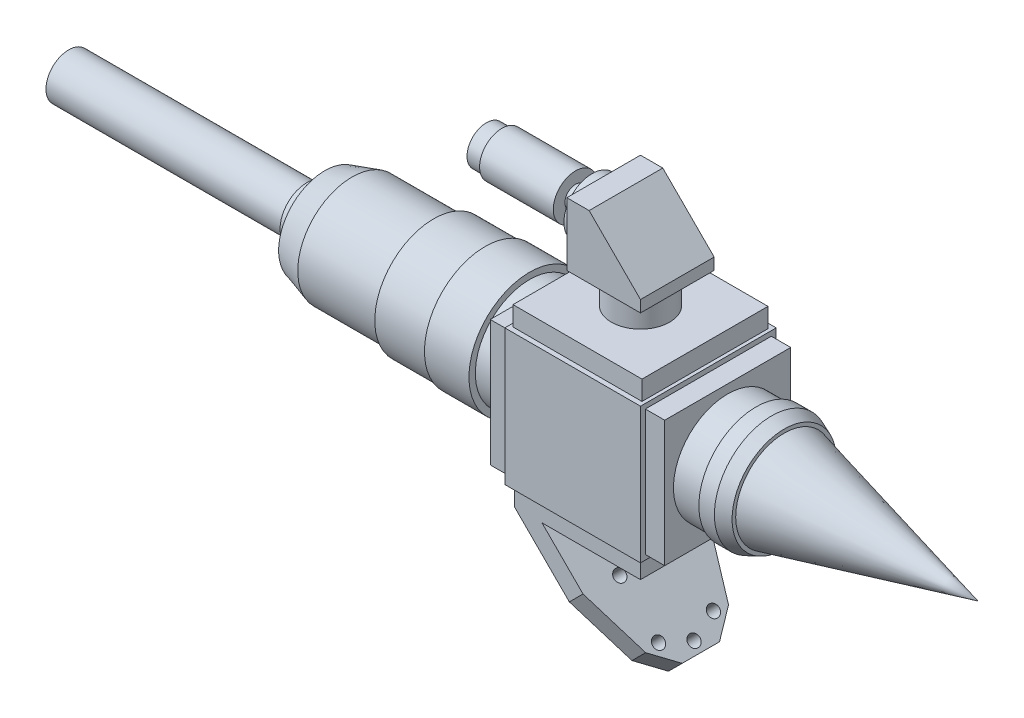
from build123d import *

# Parameters (mm, degrees)
BOSS_EXTRUDE1_DEPTH       = 35
BOSS_EXTRUDE1_DEPTH_BACK  = 35
SKETCH2_W                 = 70
SKETCH2_H                 = 70
BOSS_EXTRUDE2_DEPTH       = 32.5
BOSS_EXTRUDE2_DEPTH_BACK  = 32.5
SKETCH3_W                 = 10
SKETCH3_H                 = 65
BOSS_EXTRUDE10_DEPTH      = 32.5
BOSS_EXTRUDE10_DEPTH_BACK = 32.5
SKETCH20_W                = 10
SKETCH20_H                = 65
SKETCH6_W                 = 65
SKETCH6_H                 = 65
BOSS_EXTRUDE4_DEPTH       = 10
BOSS_EXTRUDE6_DEPTH       = 32.5
BOSS_EXTRUDE6_DEPTH_BACK  = 32.5
SKETCH12_W                = 66.54355119
SKETCH12_H                = 10
SKETCH13_W                = 15
SKETCH13_H                = 15.886543597
BOSS_EXTRUDE7_DEPTH       = 19
BOSS_EXTRUDE7_DEPTH_BACK  = 19
SKETCH16_W                = 15.65
SKETCH16_H                = 15
BOSS_EXTRUDE14_DEPTH      = 65
CUT_EXTRUDE2_REACH        = 292.31
SKETCH25_R                = 3.001207037
SKETCH25_R_2              = 3
CUT_EXTRUDE3_REACH        = 292.31


with BuildPart() as part:
    # Sketch2 → Boss-Extrude1 (new, two sides: drawn at the far end of the back side and taken through both)
    with BuildSketch(Plane.XY.offset(-BOSS_EXTRUDE1_DEPTH_BACK)):
        Rectangle(SKETCH2_W, SKETCH2_H)
    extrude(amount=BOSS_EXTRUDE1_DEPTH + BOSS_EXTRUDE1_DEPTH_BACK)

    # Sketch3 → Boss-Extrude2 (add, two sides: drawn at the far end of the back side and taken through both)
    with BuildSketch(Plane.XY.offset(-BOSS_EXTRUDE2_DEPTH_BACK)):
        with Locations((40, 0)):
            Rectangle(SKETCH3_W, SKETCH3_H)
    extrude(amount=BOSS_EXTRUDE2_DEPTH + BOSS_EXTRUDE2_DEPTH_BACK)

    # Sketch20 → Boss-Extrude10 (add, two sides: drawn at the far end of the back side and taken through both)
    with BuildSketch(Plane.XY.offset(-BOSS_EXTRUDE10_DEPTH_BACK)):
        with Locations((-40, 0)):
            Rectangle(SKETCH20_W, SKETCH20_H)
    extrude(amount=BOSS_EXTRUDE10_DEPTH + BOSS_EXTRUDE10_DEPTH_BACK)

    # Sketch4 → Revolve1 (revolve)
    with BuildSketch(Plane.XY, mode=Mode.PRIVATE) as revolve1_sk:
        Polygon((45, 28), (59.607985015, 28), (59.607985015, 29.5), (67.607985015, 29.5), (74.107985015, 26.85697368), (74.107985015, 0), (45, 0), align=None)
    revolve(revolve1_sk.sketch.rotate(Axis((126.079032841, 0, 0), (-1, 0, 0)), 90), axis=Axis((126.079032841, 0, 0), (-1, 0, 0)))

    # Sketch5 → Revolve2 (revolve)
    with BuildSketch(Plane.XY, mode=Mode.PRIVATE) as revolve2_sk:
        Polygon((74.107985015, 25), (174.107985015, 0), (74.107985015, 0), align=None)
    revolve(revolve2_sk.sketch.rotate(Axis((0, 0, 0), (1, 0, 0)), 90), axis=Axis((0, 0, 0), (1, 0, 0)))

    # Sketch11 → Revolve4 (revolve)
    with BuildSketch(Plane.XY, mode=Mode.PRIVATE) as revolve4_sk:
        Polygon((-45, 28), (-57.201085702, 28), (-57.201085702, 31.288573188), (-80.147769564, 31.288573188), (-80.147769564, 30.339674147), (-106.73557157, 30.339674147), (-106.73557157, 28), (-148.804473643, 28), (-162.901896786, 23.768340348), (-162.901896786, 13.75175022), (-172.176517275, 13.75175022), (-172.176517275, 11.711333713), (-294.985996393, 11.711333713), (-294.985996393, 0), (-45, 0), align=None)
    revolve(revolve4_sk.sketch.rotate(Axis((0, 0, 0), (-1, 0, 0)), 90), axis=Axis((0, 0, 0), (-1, 0, 0)))

    # Sketch6 → Boss-Extrude4 (add)
    with BuildSketch(Plane.XZ.offset(35)):
        Rectangle(SKETCH6_W, SKETCH6_H)
    extrude(amount=BOSS_EXTRUDE4_DEPTH)

    # Sketch12 → Boss-Extrude6 (add, two sides: drawn at the far end of the back side and taken through both)
    with BuildSketch(Plane.XY.offset(-BOSS_EXTRUDE6_DEPTH_BACK)):
        with Locations((0, 40)):
            Rectangle(SKETCH12_W, SKETCH12_H)
    extrude(amount=BOSS_EXTRUDE6_DEPTH + BOSS_EXTRUDE6_DEPTH_BACK)

    # Sketch13 → Revolve5 (revolve)
    with BuildSketch(Plane.XY, mode=Mode.PRIVATE) as revolve5_sk:
        with Locations((7.5, 52.943271799)):
            Rectangle(SKETCH13_W, SKETCH13_H)
    revolve(revolve5_sk.sketch.rotate(Axis((0, 0, 0), (0, 1, 0)), 90), axis=Axis((0, 0, 0), (0, 1, 0)))

    # Sketch14 → Boss-Extrude7 (add, two sides: drawn at the far end of the back side and taken through both)
    with BuildSketch(Plane.XY.offset(-BOSS_EXTRUDE7_DEPTH_BACK)):
        Polygon((-19, 60.650657798), (19, 60.650657798), (19, 66.650657798), (-7.5, 93.150657798), (-19, 93.150657798), align=None)
    extrude(amount=BOSS_EXTRUDE7_DEPTH + BOSS_EXTRUDE7_DEPTH_BACK)

    # Sketch15 → Revolve6 (revolve)
    with BuildSketch(Plane.XY):
        Polygon((-19, 91.400657798), (-25, 91.400657798), (-25, 82.400657798), (-33.5, 82.400657798), (-33.5, 88.400657798), (-71.5, 88.400657798), (-71.5, 86.900657798), (-79.5, 86.900657798), (-79.5, 76.900657798), (-19, 76.900657798), align=None)
    revolve(axis=Axis((23.08157289, 76.900657798, 0), (-1, 0, 0)))

    # Sketch16 → Revolve7 (revolve)
    with BuildSketch(Plane.XY):
        with Locations((-52.825, 7.5)):
            Rectangle(SKETCH16_W, SKETCH16_H)
    revolve(axis=Axis((0, 0, 0), (-1, 0, 0)))

    # Sketch24 → Boss-Extrude14 (add)
    with BuildSketch(Plane.XY.offset(32.5)):
        Polygon((-32.5, -45), (24.068542495, -101.568542495), (31.139610307, -94.497474683), (-18.357864376, -45), align=None)
    extrude(amount=-BOSS_EXTRUDE14_DEPTH)

    # Sketch25 → Cut-Extrude2 (cut, up to next)
    with BuildSketch(Plane(origin=(-38.75, -38.75, 0), x_dir=(0, 0, 1), z_dir=(-0.7071067811865438, -0.7071067811865512, 0)), mode=Mode.PRIVATE) as cut_extrude2_sk1:
        with Locations(Location((0, -83.838834765, 0), (0, 0, 270))):
            Circle(SKETCH25_R)
    cut_extrude2_tool1 = extrude(cut_extrude2_sk1.sketch, amount=-CUT_EXTRUDE2_REACH, mode=Mode.PRIVATE) & part.part
    # Sketch25 → Cut-Extrude2 (cut, up to next)
    with BuildSketch(Plane(origin=(-38.75, -38.75, 0), x_dir=(0, 0, 1), z_dir=(-0.7071067811865438, -0.7071067811865512, 0)), mode=Mode.PRIVATE) as cut_extrude2_sk2:
        with Locations(Location((-14.142135624, -49.696699141, 0), (0, 0, 270))):
            Circle(SKETCH25_R_2)
    cut_extrude2_tool2 = extrude(cut_extrude2_sk2.sketch, amount=-CUT_EXTRUDE2_REACH, mode=Mode.PRIVATE) & part.part
    # Sketch25 → Cut-Extrude2 (cut, up to next)
    with BuildSketch(Plane(origin=(-38.75, -38.75, 0), x_dir=(0, 0, 1), z_dir=(-0.7071067811865438, -0.7071067811865512, 0)), mode=Mode.PRIVATE) as cut_extrude2_sk3:
        with Locations(Location((-14.142135624, -77.980970389, 0), (0, 0, 270))):
            Circle(SKETCH25_R_2)
    cut_extrude2_tool3 = extrude(cut_extrude2_sk3.sketch, amount=-CUT_EXTRUDE2_REACH, mode=Mode.PRIVATE) & part.part
    # Sketch25 → Cut-Extrude2 (cut, up to next)
    with BuildSketch(Plane(origin=(-38.75, -38.75, 0), x_dir=(0, 0, 1), z_dir=(-0.7071067811865438, -0.7071067811865512, 0)), mode=Mode.PRIVATE) as cut_extrude2_sk4:
        with Locations(Location((14.142135624, -49.696699141, 0), (0, 0, 90))):
            Circle(SKETCH25_R_2)
    cut_extrude2_tool4 = extrude(cut_extrude2_sk4.sketch, amount=-CUT_EXTRUDE2_REACH, mode=Mode.PRIVATE) & part.part
    # Sketch25 → Cut-Extrude2 (cut, up to next)
    with BuildSketch(Plane(origin=(-38.75, -38.75, 0), x_dir=(0, 0, 1), z_dir=(-0.7071067811865438, -0.7071067811865512, 0)), mode=Mode.PRIVATE) as cut_extrude2_sk5:
        with Locations(Location((14.142135624, -77.980970389, 0), (0, 0, 90))):
            Circle(SKETCH25_R_2)
    cut_extrude2_tool5 = extrude(cut_extrude2_sk5.sketch, amount=-CUT_EXTRUDE2_REACH, mode=Mode.PRIVATE) & part.part
    add(cut_extrude2_tool1.solids().sort_by_distance((20.533009, -98.033009, 0))[0], mode=Mode.SUBTRACT)
    add(cut_extrude2_tool2.solids().sort_by_distance((-3.609127, -73.890873, -14.142136))[0], mode=Mode.SUBTRACT)
    add(cut_extrude2_tool3.solids().sort_by_distance((16.390873, -93.890873, -14.142136))[0], mode=Mode.SUBTRACT)
    add(cut_extrude2_tool4.solids().sort_by_distance((-3.609127, -73.890873, 14.142136))[0], mode=Mode.SUBTRACT)
    add(cut_extrude2_tool5.solids().sort_by_distance((16.390873, -93.890873, 14.142136))[0], mode=Mode.SUBTRACT)

    # Sketch26 → Cut-Extrude3 (cut, up to next)
    with BuildSketch(Plane(origin=(-38.75, -38.75, 0), x_dir=(0, 0, 1), z_dir=(-0.7071067811865438, -0.7071067811865512, 0)), mode=Mode.PRIVATE) as cut_extrude3_sk1:
        Polygon((-32.5, -48.838834765), (-21.370348691, -78.805078625), (-9.627269044, -88.838834765), (-32.5, -88.838834765), align=None)
    cut_extrude3_tool1 = extrude(cut_extrude3_sk1.sketch, amount=-CUT_EXTRUDE3_REACH, mode=Mode.PRIVATE) & part.part
    # Sketch26 → Cut-Extrude3 (cut, up to next)
    with BuildSketch(Plane(origin=(-38.75, -38.75, 0), x_dir=(0, 0, 1), z_dir=(-0.7071067811865438, -0.7071067811865512, 0)), mode=Mode.PRIVATE) as cut_extrude3_sk2:
        Polygon((32.5, -48.838834765), (21.370348691, -78.805078625), (9.627269044, -88.838834765), (32.5, -88.838834765), align=None)
    cut_extrude3_tool2 = extrude(cut_extrude3_sk2.sketch, amount=-CUT_EXTRUDE3_REACH, mode=Mode.PRIVATE) & part.part
    add(cut_extrude3_tool1.solids().sort_by_distance((15.48251, -92.98251, -26.196672))[0], mode=Mode.SUBTRACT)
    add(cut_extrude3_tool2.solids().sort_by_distance((15.48251, -92.98251, 26.196672))[0], mode=Mode.SUBTRACT)


solid = part.part
